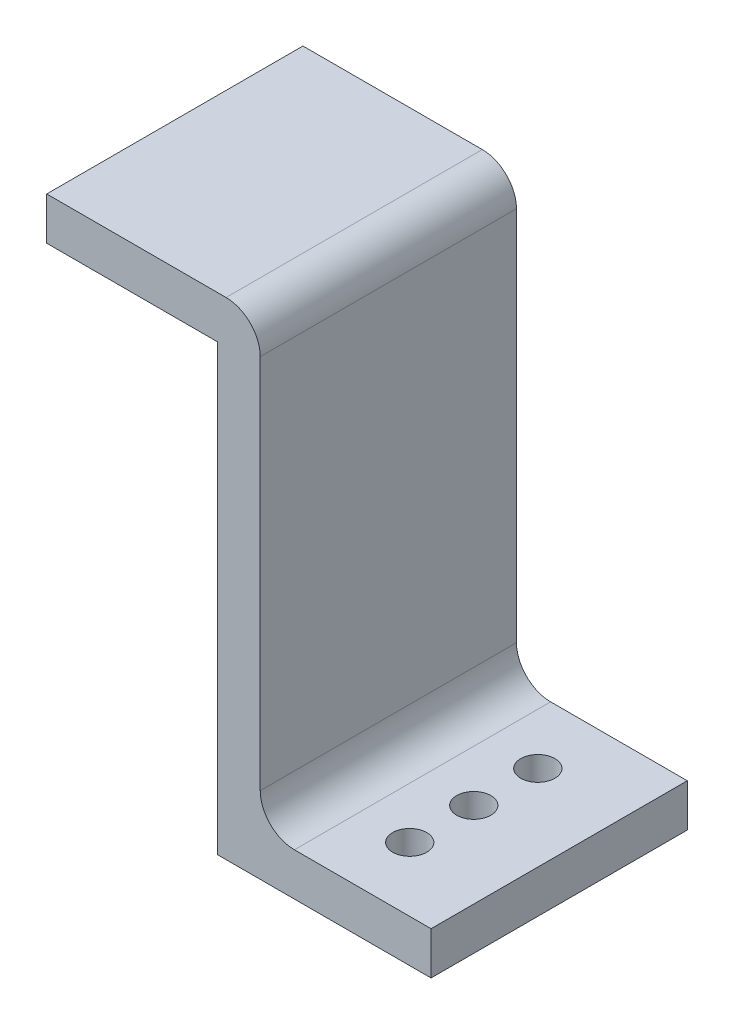
from build123d import *

# Parameters (mm, degrees)
SKETCH1_W           = 20
SKETCH1_H           = 5
SKETCH1_W_2         = 5
SKETCH1_H_2         = 57
BOSS_EXTRUDE1_DEPTH = 30
FILLET1_R           = 4
SKETCH2_R           = 2
CUT_EXTRUDE1_DEPTH  = 30


with BuildPart() as part:
    # Sketch1 → Boss-Extrude1 (new body)
    with BuildSketch(Plane.XY):
        with Locations((-12.5, 26)):
            Rectangle(SKETCH1_W, SKETCH1_H)
        Rectangle(SKETCH1_W_2, SKETCH1_H_2)
        with Locations((12.5, -26)):
            Rectangle(SKETCH1_W, SKETCH1_H)
    extrude(amount=BOSS_EXTRUDE1_DEPTH)

    # Fillet1
    fillet1_edges = [part.edges().sort_by_distance(p)[0] for p in [
        (2.5, 28.5, 15),
        (2.5, -23.5, 15),
    ]]
    fillet(fillet1_edges, radius=FILLET1_R)

    # Sketch2 → Cut-Extrude1 (cut)
    with BuildSketch(Plane(origin=(0, -23.5, 0), x_dir=(1, 0, 0), z_dir=(0, 1, 0))):
        with Locations(Location((12.5, -15, 0), (0, 0, 270))):
            Circle(SKETCH2_R)
        with Locations(Location((12.5, -22.5, 0), (0, 0, 270))):
            Circle(SKETCH2_R)
        with Locations(Location((12.5, -7.5, 0), (0, 0, 270))):
            Circle(SKETCH2_R)
    extrude(amount=-CUT_EXTRUDE1_DEPTH, mode=Mode.SUBTRACT)


solid = part.part
